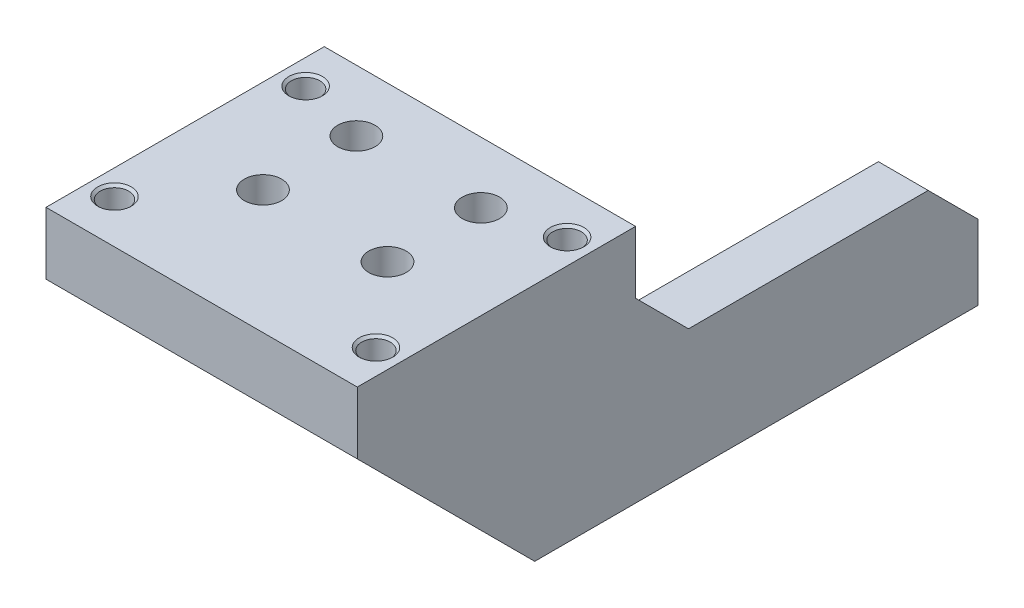
from build123d import *

# Parameters (mm, degrees)
SKETCH1_W               = 50
SKETCH1_H               = 34.7
BOSS_EXTRUDE1_DEPTH     = 10
CUT_EXTRUDE1_REACH      = 34.032
SKETCH2_R               = 1.75
SKETCH3_R               = 3
CUT_EXTRUDE2_DEPTH      = 5
SKETCH6_W               = 50
SKETCH6_H               = 10
BOSS_EXTRUDE3_DEPTH     = 10
BOSS_EXTRUDE4_DEPTH     = 8
CHAMFER1_SIZE           = 8
SKETCH10_R              = 2.3
CUT_EXTRUDE3_DEPTH      = 4.8
MIRROR2_COPY_1_SKETCH_R = 2.3
MIRROR2_COPY_1_DEPTH    = 4.8
CHAMFER2_SIZE           = 0.4


with BuildPart() as part:
    # Sketch1 → Boss-Extrude1 (new body)
    with BuildSketch(Plane(origin=(0, 0, 0), x_dir=(1, 0, 0), z_dir=(0, 1, 0))):
        Rectangle(SKETCH1_W, SKETCH1_H)
    extrude(amount=BOSS_EXTRUDE1_DEPTH)

    # Sketch2 → Cut-Extrude1 (cut, up to next)
    with BuildSketch(Plane(origin=(0, 10, 0), x_dir=(1, 0, 0), z_dir=(0, 1, 0)), mode=Mode.PRIVATE) as cut_extrude1_sk1:
        with Locations(Location((-10, 7.5, 0), (0, 0, 270))):
            Circle(SKETCH2_R)
    cut_extrude1_tool1 = extrude(cut_extrude1_sk1.sketch, amount=-CUT_EXTRUDE1_REACH, mode=Mode.PRIVATE) & part.part
    # Sketch2 → Cut-Extrude1 (cut, up to next)
    with BuildSketch(Plane(origin=(0, 10, 0), x_dir=(1, 0, 0), z_dir=(0, 1, 0)), mode=Mode.PRIVATE) as cut_extrude1_sk2:
        with Locations(Location((10, 7.5, 0), (0, 0, 270))):
            Circle(SKETCH2_R)
    cut_extrude1_tool2 = extrude(cut_extrude1_sk2.sketch, amount=-CUT_EXTRUDE1_REACH, mode=Mode.PRIVATE) & part.part
    # Sketch2 → Cut-Extrude1 (cut, up to next)
    with BuildSketch(Plane(origin=(0, 10, 0), x_dir=(1, 0, 0), z_dir=(0, 1, 0)), mode=Mode.PRIVATE) as cut_extrude1_sk3:
        with Locations(Location((10, -7.5, 0), (0, 0, 270))):
            Circle(SKETCH2_R)
    cut_extrude1_tool3 = extrude(cut_extrude1_sk3.sketch, amount=-CUT_EXTRUDE1_REACH, mode=Mode.PRIVATE) & part.part
    # Sketch2 → Cut-Extrude1 (cut, up to next)
    with BuildSketch(Plane(origin=(0, 10, 0), x_dir=(1, 0, 0), z_dir=(0, 1, 0)), mode=Mode.PRIVATE) as cut_extrude1_sk4:
        with Locations(Location((-10, -7.5, 0), (0, 0, 270))):
            Circle(SKETCH2_R)
    cut_extrude1_tool4 = extrude(cut_extrude1_sk4.sketch, amount=-CUT_EXTRUDE1_REACH, mode=Mode.PRIVATE) & part.part
    add(cut_extrude1_tool1.solids().sort_by_distance((-10, 10, -7.5))[0], mode=Mode.SUBTRACT)
    add(cut_extrude1_tool2.solids().sort_by_distance((10, 10, -7.5))[0], mode=Mode.SUBTRACT)
    add(cut_extrude1_tool3.solids().sort_by_distance((10, 10, 7.5))[0], mode=Mode.SUBTRACT)
    add(cut_extrude1_tool4.solids().sort_by_distance((-10, 10, 7.5))[0], mode=Mode.SUBTRACT)

    # Sketch3 → Cut-Extrude2 (cut)
    with BuildSketch(Plane(origin=(0, 10, 0), x_dir=(1, 0, 0), z_dir=(0, 1, 0))):
        with Locations(Location((-10, 7.5, 0), (0, 0, 270))):
            Circle(SKETCH3_R)
        with Locations(Location((10, 7.5, 0), (0, 0, 270))):
            Circle(SKETCH3_R)
        with Locations(Location((10, -7.5, 0), (0, 0, 270))):
            Circle(SKETCH3_R)
        with Locations(Location((-10, -7.5, 0), (0, 0, 270))):
            Circle(SKETCH3_R)
    extrude(amount=-CUT_EXTRUDE2_DEPTH, mode=Mode.SUBTRACT)

    # Sketch6 → Boss-Extrude3 (add)
    with BuildSketch(Plane.XZ):
        with Locations((0, 22.35)):
            Rectangle(SKETCH6_W, SKETCH6_H)
    extrude(amount=-BOSS_EXTRUDE3_DEPTH)

    # Sketch8 → Boss-Extrude4 (add)
    with BuildSketch(Plane(origin=(25, 0, 0), x_dir=(0, 0, -1), z_dir=(1, 0, 0))):
        Polygon((-27.35, 0), (17.35, 0), (25.85, -8.5), (72.35, -8.5), (72.35, -28.5), (1.15, -28.5), align=None)
    extrude(amount=-BOSS_EXTRUDE4_DEPTH)

    # Chamfer1
    chamfer1_edges = [part.edges().sort_by_distance(p)[0] for p in [
        (21, -8.5, -72.35),
    ]]
    chamfer(chamfer1_edges, length=CHAMFER1_SIZE)

    # Sketch10 → Cut-Extrude3 (cut)
    with BuildSketch(Plane(origin=(0, 10, 0), x_dir=(1, 0, 0), z_dir=(0, 1, 0))):
        with Locations(Location((21, 10.35, 0), (0, 0, 270))):
            Circle(SKETCH10_R)
    cut_extrude3 = extrude(amount=-CUT_EXTRUDE3_DEPTH, mode=Mode.SUBTRACT)

    # Mirror1: Cut-Extrude3 across plane
    add(cut_extrude3.mirror(Plane(origin=(0, 0, 5), x_dir=(1, 0, 0), z_dir=(0, 0, -1))), mode=Mode.SUBTRACT)

    # Mirror2: Cut-Extrude3 across plane
    add(cut_extrude3.mirror(Plane.ZY), mode=Mode.SUBTRACT)

    # Mirror2 copy 1 sketch → Mirror2 copy 1 (cut)
    with BuildSketch(Plane(origin=(0, 10, 10), x_dir=(-1, 0, 0), z_dir=(0, 1, 0))):
        with Locations(Location((21, 10.35, 0), (0, 0, 270))):
            Circle(MIRROR2_COPY_1_SKETCH_R)
    extrude(amount=-MIRROR2_COPY_1_DEPTH, mode=Mode.SUBTRACT)

    # Chamfer2
    chamfer2_edges = [part.edges().sort_by_distance(p)[0] for p in [
        (-21, 10, -12.65),
        (-21, 10, 22.65),
        (21, 10, -12.65),
        (21, 10, 22.65),
    ]]
    chamfer(chamfer2_edges, length=CHAMFER2_SIZE)


solid = part.part
